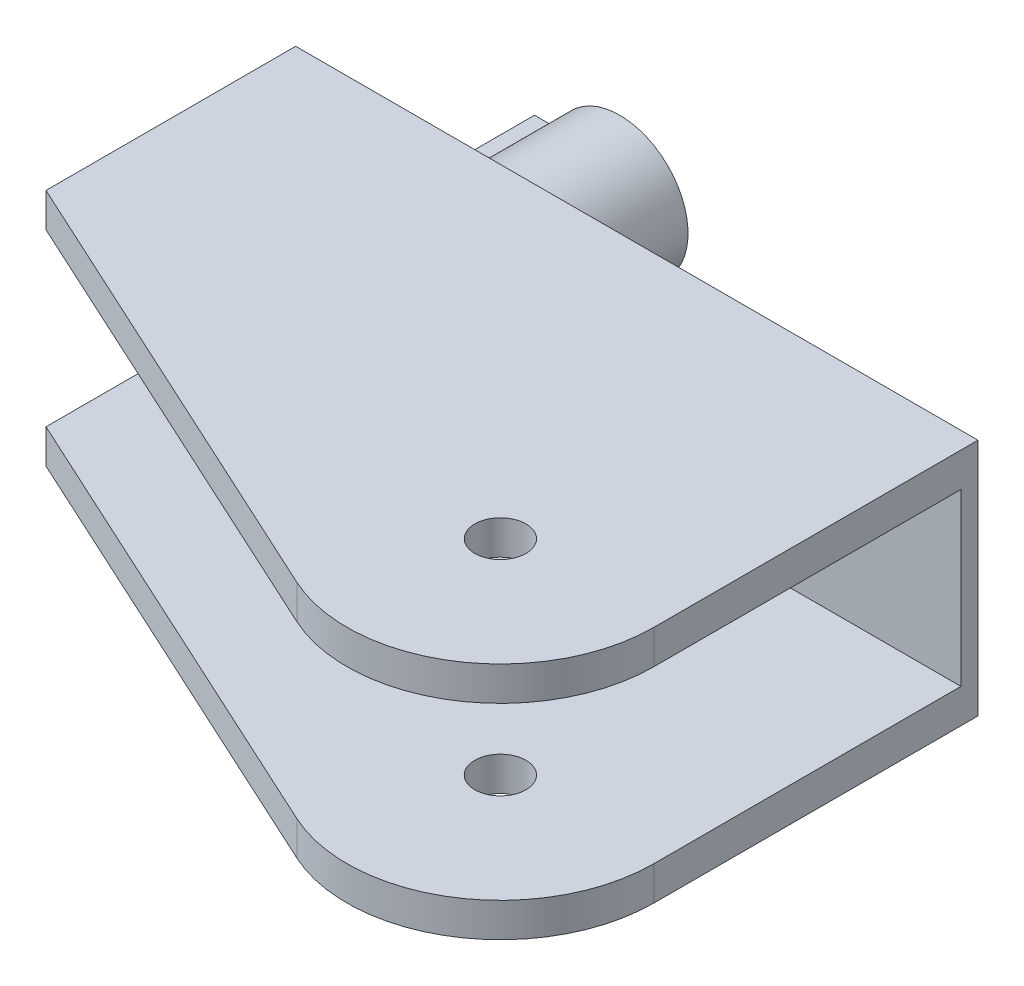
from build123d import *

# Parameters (mm, degrees)
SKETCH_1_R          = 7.5
EXTRUDE_1_DEPTH     = 10
SKETCH_3_W          = 5
SKETCH_3_H          = 35
EXTRUDE_2_DEPTH     = 200
EXTRUDE_START       = -60
SKETCH_1_2_R        = 7.5
EXTRUDE_3_DEPTH     = 60
SKETCH_7_W          = 135
SKETCH_7_H          = 50
CUT_EXTRUDE_1_DEPTH = 230.401394939
EXTRUDE_4_DEPTH     = 45


with BuildPart() as part:
    # 草图1 → 凸台-拉伸1 (new body)
    with BuildSketch(Plane(origin=(0, 0, 0), x_dir=(1, 0, 0), z_dir=(0, 1, 0))):
        with BuildLine():
            Line((45, 0), (45, 90))
            Line((45, 90), (-155, 90))
            Line((-155, 90), (-155, 21.804554274))
            Line((-155, 21.804554274), (-18.814985094, -40.877822054))
            ThreePointArc((-18.814985094, -40.877822054), (24.272676725, -37.892442051), (45, 0))
        make_face()
        with Locations(Location((0, 0, 0), (0, 0, 270))):
            Circle(SKETCH_1_R, mode=Mode.SUBTRACT)
    extrude(amount=EXTRUDE_1_DEPTH)

    # 草图3 → 凸台-拉伸2 (add)
    with BuildSketch(Plane(origin=(45, 0, 0), x_dir=(0, 0, -1), z_dir=(1, 0, 0))):
        with Locations((92.5, -7.5)):
            Rectangle(SKETCH_3_W, SKETCH_3_H)
    extrude_2 = extrude(amount=-EXTRUDE_2_DEPTH)

    # 镜向5: 凸台-拉伸2 across plane
    add(extrude_2.mirror(Plane(origin=(0, -25, 0), x_dir=(0, 0, 1), z_dir=(0, -1, 0))))

    # 草图1<2> → 凸台-拉伸3 (add)
    with BuildSketch(Plane(origin=(0, 0, 0), x_dir=(1, 0, 0), z_dir=(0, 1, 0)).offset(EXTRUDE_START)):
        with BuildLine():
            Line((45, 0), (45, 90))
            Line((45, 90), (-155, 90))
            Line((-155, 90), (-155, 21.804554274))
            Line((-155, 21.804554274), (-18.814985094, -40.877822054))
            ThreePointArc((-18.814985094, -40.877822054), (24.272676725, -37.892442051), (45, 0))
        make_face()
        with Locations(Location((0, 0, 0), (0, 0, 90))):
            Circle(SKETCH_1_2_R, mode=Mode.SUBTRACT)
    extrude(amount=EXTRUDE_3_DEPTH)

    # 草图7 → 切除-拉伸1 (cut, through all)
    with BuildSketch(Plane(origin=(45, 0, 0), x_dir=(0, 0, -1), z_dir=(1, 0, 0))):
        with Locations((22.5, -25)):
            Rectangle(SKETCH_7_W, SKETCH_7_H)
    extrude(amount=-CUT_EXTRUDE_1_DEPTH, mode=Mode.SUBTRACT)

    # 草图8 → 凸台-拉伸4 (add)
    with BuildSketch(Plane(origin=(0, 0, -95), x_dir=(-1, 0, 0), z_dir=(0, 0, -1))):
        with BuildLine():
            Line((123.540496218, -17.5), (130, -17.5))
            Line((130, -17.5), (130, -32.5))
            Line((130, -32.5), (123.540496218, -32.5))
            ThreePointArc((123.540496218, -32.5), (85, -25), (123.540496218, -17.5))
        make_face()
    extrude(amount=EXTRUDE_4_DEPTH)


solid = part.part
